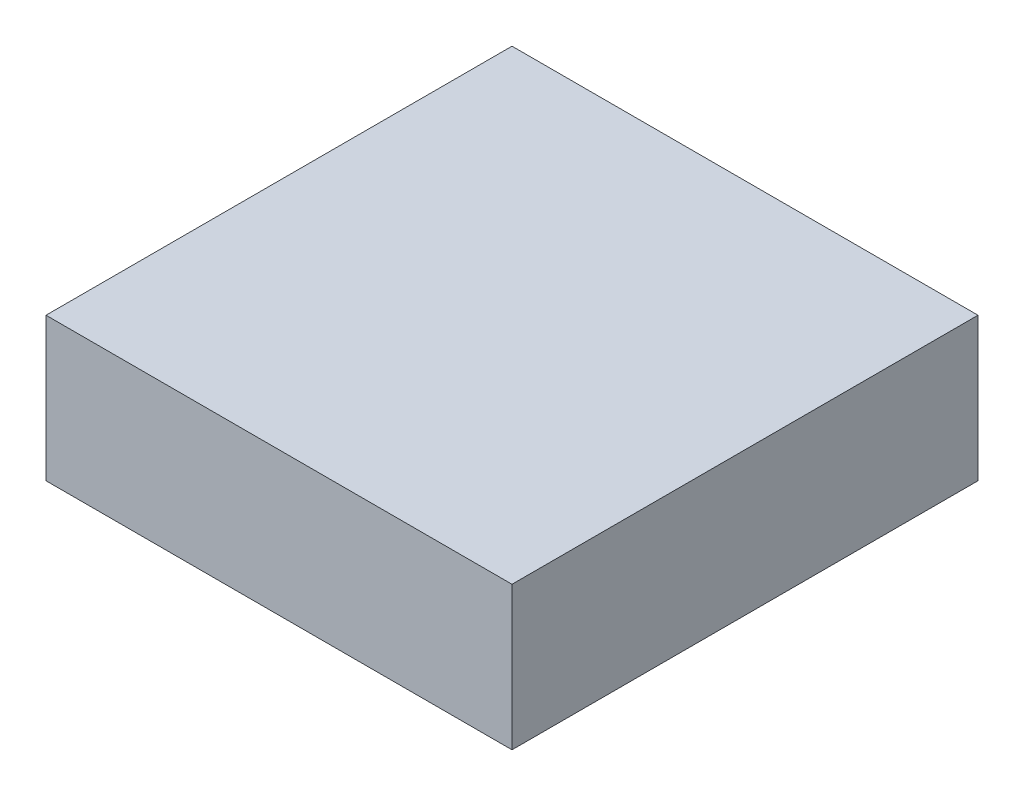
from build123d import *

# Parameters (mm, degrees)
SKETCH_1_W      = 130
SKETCH_1_H      = 130
EXTRUDE_1_DEPTH = 40


with BuildPart() as part:
    # 草图1 → 凸台-拉伸1 (new body)
    with BuildSketch(Plane(origin=(0, 0, 0), x_dir=(1, 0, 0), z_dir=(0, 1, 0))):
        Rectangle(SKETCH_1_W, SKETCH_1_H)
    extrude(amount=EXTRUDE_1_DEPTH)


solid = part.part
